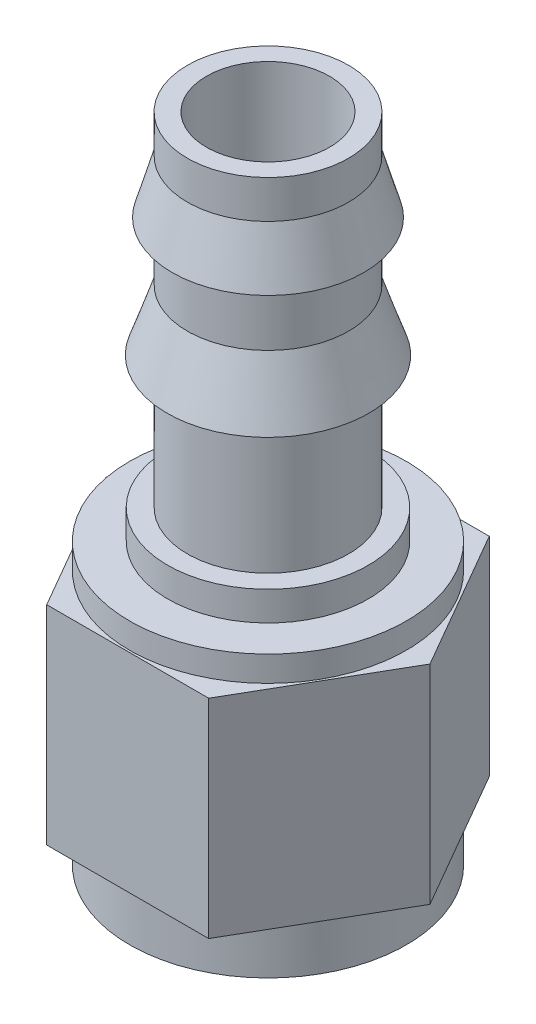
from build123d import *

# Parameters (mm, degrees)
BOSS_EXTRUDE1_DEPTH = 16.4
SKETCH3_R           = 4.85
CUT_EXTRUDE1_DEPTH  = 55.101495482


with BuildPart() as part:
    # Sketch1 → Revolve1 (revolve)
    with BuildSketch(Plane.XY, mode=Mode.PRIVATE) as revolve1_sk:
        Polygon((0, 51.4), (0, 0), (10.9, 0), (10.9, 3.8), (11.05, 3.8), (11.05, 20.1), (10.9, 20.1), (10.9, 22.1), (7.9, 22.1), (7.9, 24.4), (6.35, 24.4), (6.35, 34.8), (7.95, 34.8), (6.35, 39.6), (6.35, 44.2), (7.55, 44.2), (6.35, 48.4), (6.35, 51.4), align=None)
    revolve(revolve1_sk.sketch.rotate(Axis((0, 51.4, 0), (0, -1, 0)), 180), axis=Axis((0, 51.4, 0), (0, -1, 0)))

    # Sketch2 → Boss-Extrude1 (add)
    with BuildSketch(Plane(origin=(0, 20.1, 0), x_dir=(1, 0, 0), z_dir=(0, 1, 0))):
        Polygon((12.761813873, 0), (6.380906937, 11.052055013), (-6.380906937, 11.052055013), (-12.761813873, 0), (-6.380906937, -11.052055013), (6.380906937, -11.052055013), align=None)
    extrude(amount=-BOSS_EXTRUDE1_DEPTH)

    # Sketch3 → Cut-Extrude1 (cut, through all)
    with BuildSketch(Plane(origin=(0, 51.4, 0), x_dir=(1, 0, 0), z_dir=(0, 1, 0))):
        with Locations(Location((0, 0, 0), (0, 0, 180))):
            Circle(SKETCH3_R)
    extrude(amount=-CUT_EXTRUDE1_DEPTH, mode=Mode.SUBTRACT)


solid = part.part
